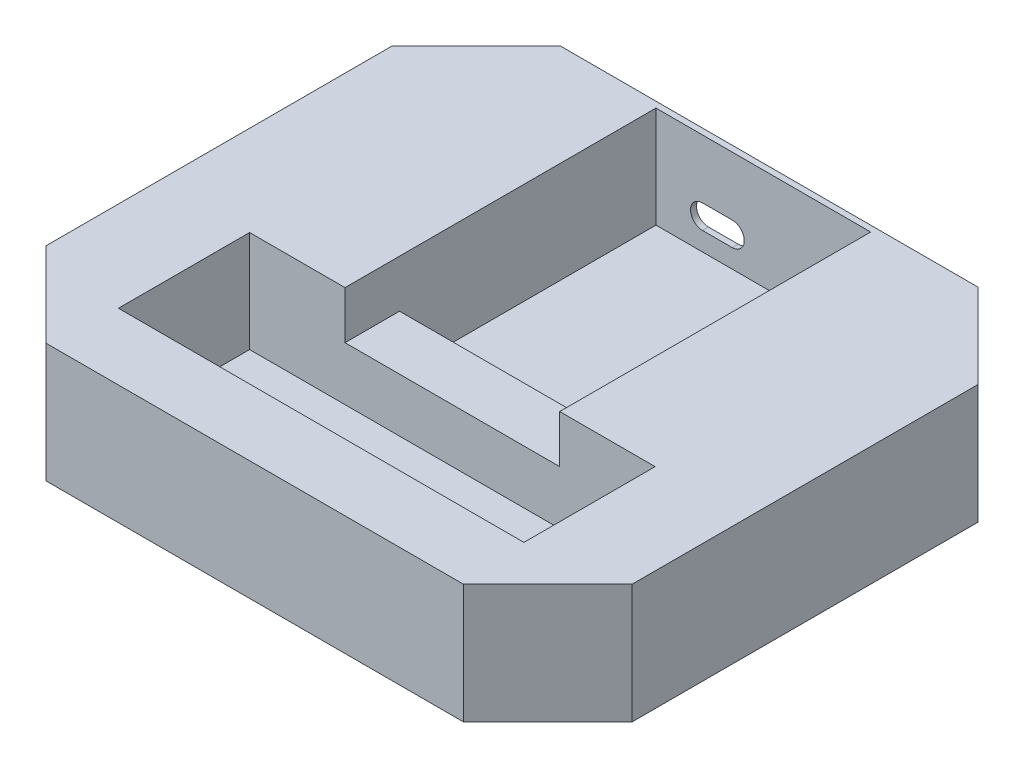
from build123d import *

# Parameters (mm, degrees)
BOSS_EXTRUDE1_DEPTH = 20
SKETCH2_W           = 36
SKETCH2_H           = 43
SKETCH2_W_2         = 68
SKETCH2_H_2         = 22
CUT_EXTRUDE1_DEPTH  = 17
SKETCH3_W           = 36
SKETCH3_H           = 9.142135624
CUT_EXTRUDE2_DEPTH  = 8
CUT_EXTRUDE3_REACH  = 102.441


with BuildPart() as part:
    # Sketch1 → Boss-Extrude1 (new body)
    with BuildSketch(Plane(origin=(0, 0, 0), x_dir=(1, 0, 0), z_dir=(0, 1, 0))):
        Polygon((-35, 43.142135624), (35, 43.142135624), (49.142135624, 29), (49.142135624, -29), (35, -43.142135624), (-35, -43.142135624), (-49.142135624, -29), (-49.142135624, 29), align=None)
    extrude(amount=BOSS_EXTRUDE1_DEPTH)

    # Sketch2 → Cut-Extrude1 (cut)
    with BuildSketch(Plane(origin=(0, 20, 0), x_dir=(1, 0, 0), z_dir=(0, 1, 0))):
        with Locations((0, 20.642135624)):
            Rectangle(SKETCH2_W, SKETCH2_H)
        with Locations((0, -21)):
            Rectangle(SKETCH2_W_2, SKETCH2_H_2)
    extrude(amount=-CUT_EXTRUDE1_DEPTH, mode=Mode.SUBTRACT)

    # Sketch3 → Cut-Extrude2 (cut)
    with BuildSketch(Plane(origin=(0, 20, 0), x_dir=(1, 0, 0), z_dir=(0, 1, 0))):
        with Locations((0, -5.428932188)):
            Rectangle(SKETCH3_W, SKETCH3_H)
    extrude(amount=-CUT_EXTRUDE2_DEPTH, mode=Mode.SUBTRACT)

    # Sketch4 → Cut-Extrude3 (cut, up to next)
    with BuildSketch(Plane.XY.offset(-42.142135624), mode=Mode.PRIVATE) as cut_extrude3_sk1:
        with BuildLine():
            Line((-10.2, 10.13), (-5.2, 10.13))
            ThreePointArc((-5.2, 10.13), (-3.2, 8.13), (-5.2, 6.13))
            Line((-5.2, 6.13), (-10.2, 6.13))
            ThreePointArc((-10.2, 6.13), (-12.2, 8.13), (-10.2, 10.13))
        make_face()
    cut_extrude3_tool1 = extrude(cut_extrude3_sk1.sketch, amount=-CUT_EXTRUDE3_REACH, mode=Mode.PRIVATE) & part.part
    add(cut_extrude3_tool1.solids().sort_by_distance((-7.7, 8.13, -42.142136))[0], mode=Mode.SUBTRACT)


solid = part.part
